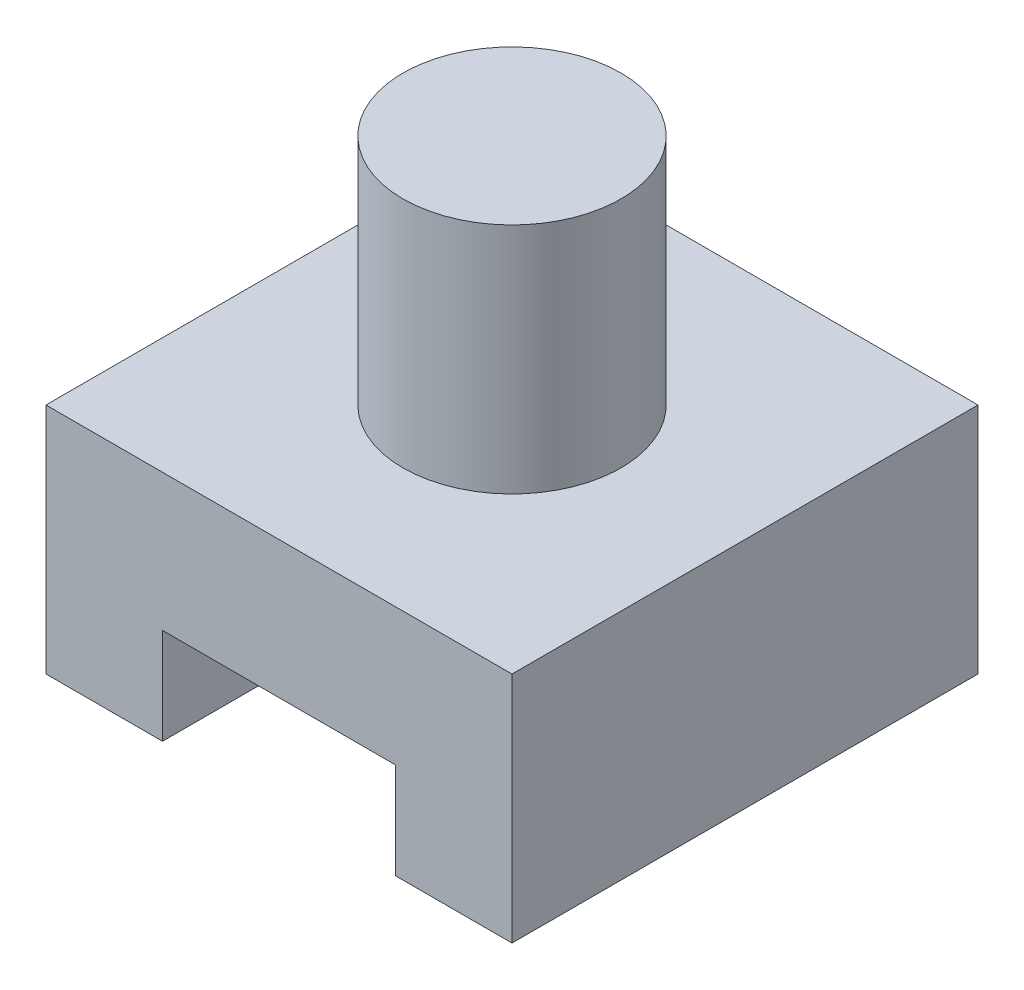
from build123d import *

# Parameters (mm, degrees)
SKETCH2_W           = 40
SKETCH2_H           = 40
BOSS_EXTRUDE1_DEPTH = 20
SKETCH4_W           = 20
SKETCH4_H           = 8.242576467
CUT_EXTRUDE1_DEPTH  = 44
SKETCH6_R           = 9.359671937
BOSS_EXTRUDE3_DEPTH = 20


with BuildPart() as part:
    # Sketch2 → Boss-Extrude1 (new body)
    with BuildSketch(Plane(origin=(0, 0, 0), x_dir=(1, 0, 0), z_dir=(0, 1, 0))):
        with Locations((20, 20)):
            Rectangle(SKETCH2_W, SKETCH2_H)
    extrude(amount=BOSS_EXTRUDE1_DEPTH)

    # Sketch4 → Cut-Extrude1 (cut)
    with BuildSketch(Plane.XY):
        with Locations((20, 4.121288234)):
            Rectangle(SKETCH4_W, SKETCH4_H)
    extrude(amount=-CUT_EXTRUDE1_DEPTH, mode=Mode.SUBTRACT)

    # Sketch6 → Boss-Extrude3 (add)
    with BuildSketch(Plane(origin=(0, 20, 0), x_dir=(1, 0, 0), z_dir=(0, 1, 0))):
        with Locations(Location((20, 20, 0), (0, 0, 270))):
            Circle(SKETCH6_R)
    extrude(amount=BOSS_EXTRUDE3_DEPTH)


solid = part.part
